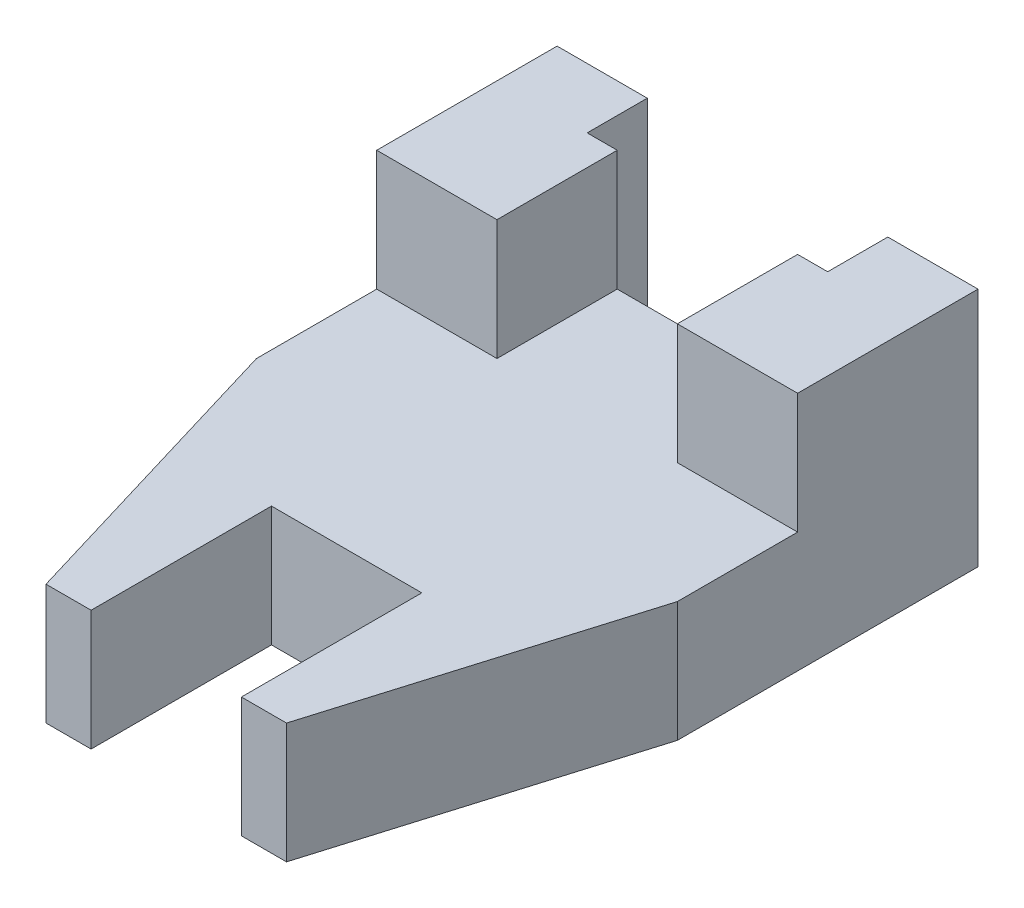
from build123d import *

# Parameters (mm, degrees)
BOSS_EXTRUDE1_DEPTH = 20
BOSS_EXTRUDE2_DEPTH = 40
SKETCH1_4_W         = 30
SKETCH1_4_H         = 20
BOSS_EXTRUDE3_DEPTH = 20


with BuildPart() as part:
    # Sketch1 → Boss-Extrude1 (new body)
    with BuildSketch(Plane(origin=(0, 0, 0), x_dir=(1, 0, 0), z_dir=(0, 1, 0))):
        Polygon((0, -30), (0, -50), (15, -100), (22.5, -100), (22.5, -70), (47.5, -70), (47.5, -100), (55, -100), (70, -50), (70, -30), align=None)
    extrude(amount=BOSS_EXTRUDE1_DEPTH)

    # Sketch1<3> → Boss-Extrude2 (add)
    with BuildSketch(Plane(origin=(0, 0, 0), x_dir=(1, 0, 0), z_dir=(0, 1, 0))):
        Polygon((15, 0), (0, 0), (0, -30), (20, -30), (20, -10), (15, -10), align=None)
        Polygon((50, -10), (50, -30), (70, -30), (70, 0), (55, 0), (55, -10), align=None)
    extrude(amount=BOSS_EXTRUDE2_DEPTH)

    # Sketch1<4> → Boss-Extrude3 (add)
    with BuildSketch(Plane(origin=(0, 0, 0), x_dir=(1, 0, 0), z_dir=(0, 1, 0))):
        with Locations((35, -20)):
            Rectangle(SKETCH1_4_W, SKETCH1_4_H)
    extrude(amount=BOSS_EXTRUDE3_DEPTH)


solid = part.part
